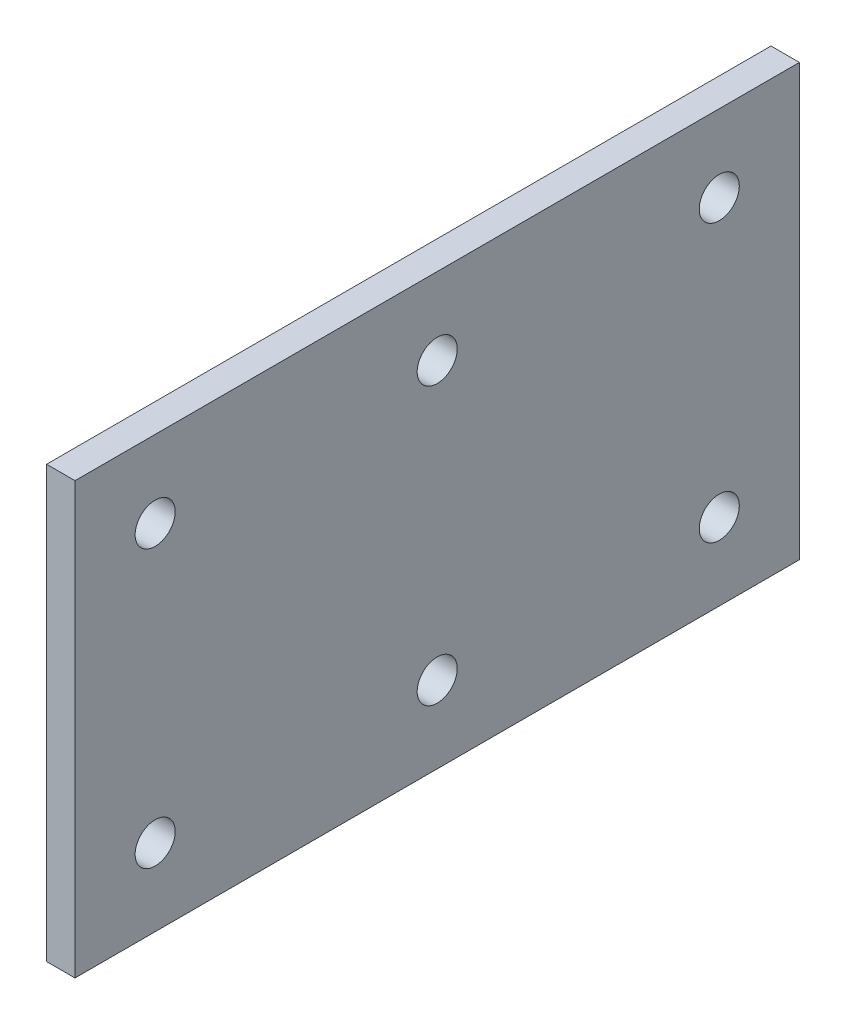
from build123d import *

# Parameters (mm, degrees)
SKETCH1_W           = 86.0806
SKETCH1_H           = 51.181
BOSS_EXTRUDE1_DEPTH = 3.3782
SKETCH3_R           = 2.38125
CUT_EXTRUDE1_DEPTH  = 3.3782


with BuildPart() as part:
    # Sketch1 → Boss-Extrude1 (new body)
    with BuildSketch(Plane(origin=(0, 0, 0), x_dir=(0, 0, -1), z_dir=(1, 0, 0))):
        with Locations((10.176029387, 1.635292812)):
            Rectangle(SKETCH1_W, SKETCH1_H)
    extrude(amount=BOSS_EXTRUDE1_DEPTH)

    # Sketch3 → Cut-Extrude1 (cut)
    with BuildSketch(Plane(origin=(3.3782, 0, 0), x_dir=(0, 0, -1), z_dir=(1, 0, 0))):
        with Locations((-23.339270613, 18.081792812)):
            Circle(SKETCH3_R)
        with Locations((43.691329387, 18.081792812)):
            Circle(SKETCH3_R)
        with Locations((43.691329387, -14.811207188)):
            Circle(SKETCH3_R)
        with Locations((-23.339270613, -14.811207188)):
            Circle(SKETCH3_R)
        with Locations((10.176029387, 18.081792812)):
            Circle(SKETCH3_R)
        with Locations((10.176029387, -14.811207188)):
            Circle(SKETCH3_R)
    extrude(amount=-CUT_EXTRUDE1_DEPTH, mode=Mode.SUBTRACT)


solid = part.part
